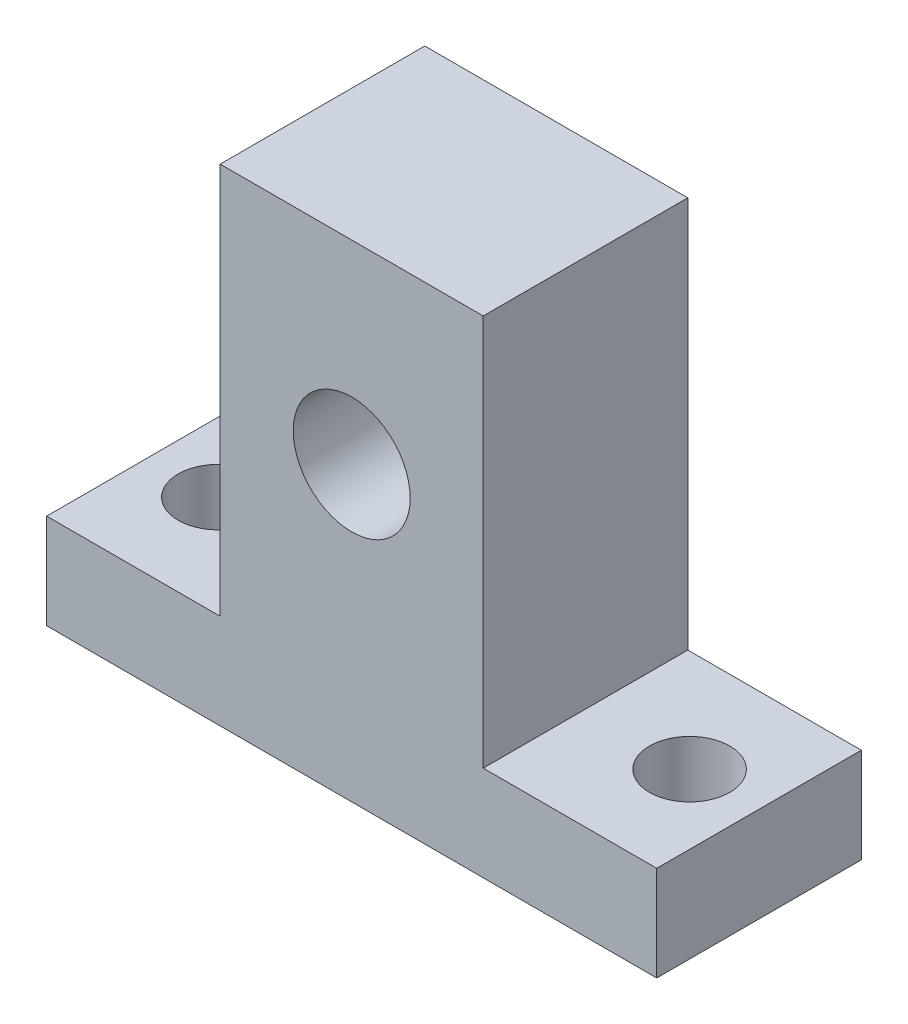
from build123d import *

# Parameters (mm, degrees)
SKETCH1_W               = 41.75
SKETCH1_H               = 14
BOSS_EXTRUDE1_DEPTH     = 6.5
SKETCH2_W               = 18
SKETCH2_H               = 14
BOSS_EXTRUDE2_DEPTH     = 26.8
CUT_EXTRUDE1_DEPTH      = 56.20826478
CUT_EXTRUDE1_DEPTH_BACK = 56.20826478
SKETCH3_R               = 4
SKETCH4_R               = 2.75
CUT_EXTRUDE2_DEPTH      = 52.549030059


with BuildPart() as part:
    # Sketch1 → Boss-Extrude1 (new body)
    with BuildSketch(Plane(origin=(0, 0, 0), x_dir=(1, 0, 0), z_dir=(0, 1, 0))):
        with Locations((20.875, 7)):
            Rectangle(SKETCH1_W, SKETCH1_H)
    extrude(amount=BOSS_EXTRUDE1_DEPTH)

    # Sketch2 → Boss-Extrude2 (add)
    with BuildSketch(Plane(origin=(0, 6.5, 0), x_dir=(1, 0, 0), z_dir=(0, 1, 0))):
        with Locations((20.875, 7)):
            Rectangle(SKETCH2_W, SKETCH2_H)
    extrude(amount=BOSS_EXTRUDE2_DEPTH)

    # Sketch3 → Cut-Extrude1 (cut, two sides: drawn at the far end of the back side and taken through both)
    with BuildSketch(Plane.XY.offset(-CUT_EXTRUDE1_DEPTH_BACK)):
        with Locations((20.875, 20)):
            Circle(SKETCH3_R)
    extrude(amount=CUT_EXTRUDE1_DEPTH + CUT_EXTRUDE1_DEPTH_BACK, mode=Mode.SUBTRACT)

    # Sketch4 → Cut-Extrude2 (cut, through all)
    with BuildSketch(Plane(origin=(0, 6.5, 0), x_dir=(1, 0, 0), z_dir=(0, 1, 0))):
        with Locations(Location((37, 7, 0), (0, 0, 270))):
            Circle(SKETCH4_R)
        with Locations(Location((4.75, 7, 0), (0, 0, 270))):
            Circle(SKETCH4_R)
    extrude(amount=-CUT_EXTRUDE2_DEPTH, mode=Mode.SUBTRACT)


solid = part.part
